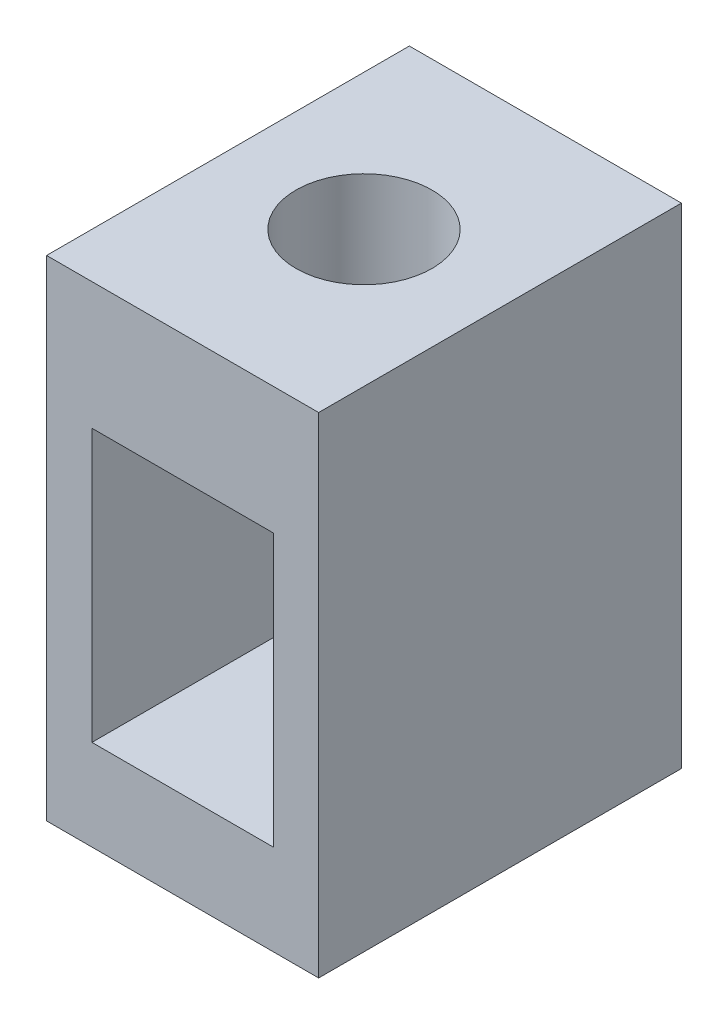
from build123d import *

# Parameters (mm, degrees)
SKETCH_1_W          = 3
SKETCH_1_H          = 5.4
EXTRUDE_1_DEPTH     = 4
SKETCH_2_W          = 2
SKETCH_2_H          = 3
CUT_EXTRUDE_1_DEPTH = 6.053711507
CUT_EXTRUDE_2_REACH = 8.885
SKETCH_3_R          = 0.75


with BuildPart() as part:
    # Эскиз1 → Бобышка-Вытянуть1 (new body)
    with BuildSketch(Plane.XY):
        Rectangle(SKETCH_1_W, SKETCH_1_H)
    extrude(amount=-EXTRUDE_1_DEPTH)

    # Эскиз2 → Вырез-Вытянуть1 (cut, through all)
    with BuildSketch(Plane.XY):
        with Locations((0, -0.2)):
            Rectangle(SKETCH_2_W, SKETCH_2_H)
    extrude(amount=-CUT_EXTRUDE_1_DEPTH, mode=Mode.SUBTRACT)

    # Эскиз3 → Вырез-Вытянуть2 (cut, up to next)
    with BuildSketch(Plane(origin=(0, 2.7, 0), x_dir=(1, 0, 0), z_dir=(0, 1, 0)), mode=Mode.PRIVATE) as cut_extrude_2_sk1:
        with Locations(Location((0, 2, 0), (0, 0, 270))):
            Circle(SKETCH_3_R)
    cut_extrude_2_tool1 = extrude(cut_extrude_2_sk1.sketch, amount=-CUT_EXTRUDE_2_REACH, mode=Mode.PRIVATE) & part.part
    add(cut_extrude_2_tool1.solids().sort_by_distance((0, 2.7, -2))[0], mode=Mode.SUBTRACT)


solid = part.part
